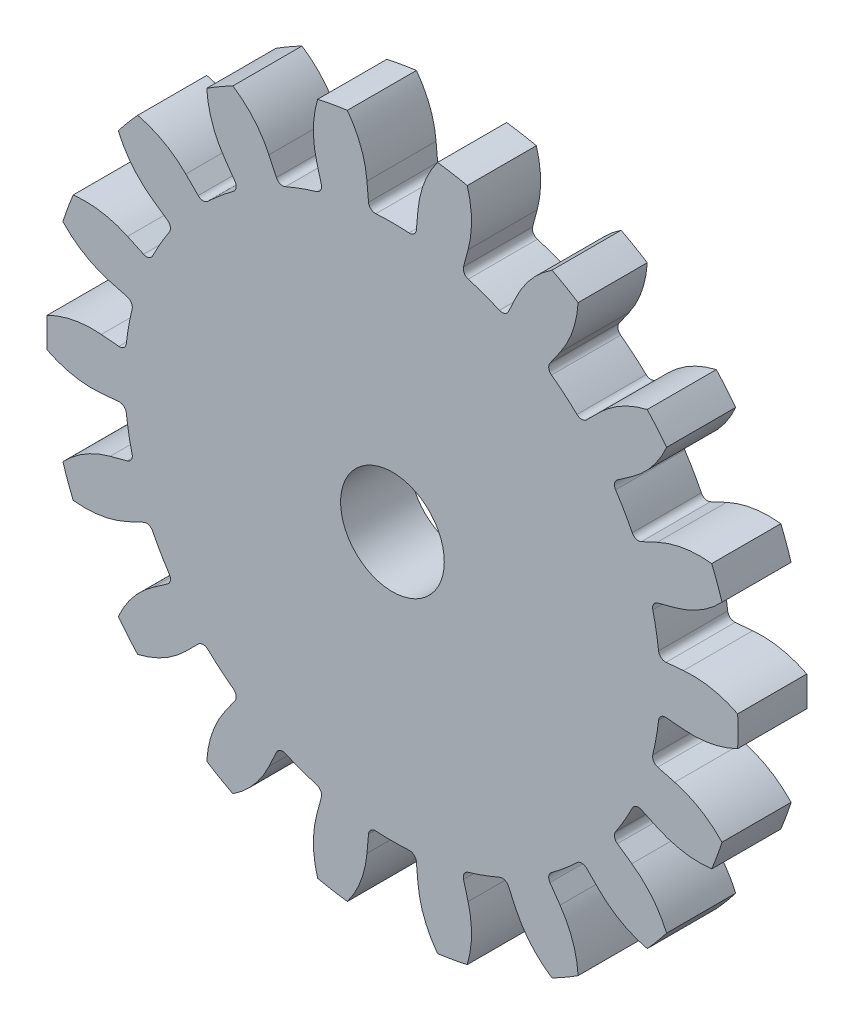
from build123d import *

# Parameters (mm, degrees)
BOSS_EXTRUDE1_DEPTH      = 10
FILLET1_R                = 1
CIRPATTERN1_COUNT        = 18
FILLET1_OF_CIRPATTERN1_R = 1
SKETCH2_R                = 7.5
CUT_EXTRUDE1_DEPTH       = 72.115450381


with BuildPart() as part:
    # Sketch1 → Boss-Extrude1 (new body)
    with BuildSketch(Plane.XY):
        with BuildLine():
            Line((42.124092809, 3.685380582), (38.602544551, 3.377285031))
            ThreePointArc((38.602544551, 3.377285031), (38.418488378, 5.057889949), (38.161300429, 6.728866885))
            Line((38.161300429, 6.728866885), (0, 0))
            Line((0, 0), (38.161300429, -6.728866885))
            ThreePointArc((38.161300429, -6.728866885), (38.418488378, -5.057889949), (38.602544551, -3.377285031))
            Line((38.602544551, -3.377285031), (42.124092809, -3.685380582))
            ThreePointArc((42.124092809, -3.685380582), (46.143152518, -3.4790331), (49.952411079, -2.180969368))
            ThreePointArc((49.952411079, -2.180969368), (50, 0), (49.952411079, 2.180969368))
            ThreePointArc((49.952411079, 2.180969368), (46.143152518, 3.4790331), (42.124092809, 3.685380582))
        make_face()
    boss_extrude1 = extrude(amount=BOSS_EXTRUDE1_DEPTH)

    # Fillet1
    fillet1_edges = [part.edges().sort_by_distance(p)[0] for p in [
        (38.602544551, 3.377285031, 5),
        (38.602544551, -3.377285031, 5),
    ]]
    fillet(fillet1_edges, radius=FILLET1_R)

    # CirPattern1: Boss-Extrude1 ×18 about axis
    cirpattern1_axis = Axis((0, 0, 0), (0, 0, 1))
    for i in range(1, CIRPATTERN1_COUNT):
        add(boss_extrude1.rotate(cirpattern1_axis, i * 360 / CIRPATTERN1_COUNT))

    # Fillet1 of CirPattern1
    fillet1_of_cirpattern1_edges = [part.edges().sort_by_distance(p)[0] for p in [
        (35.119426748, 16.376457642, 5),
        (37.429625769, 10.029237998, 5),
        (27.400387771, 27.400387771, 5),
        (31.742141716, 22.226086909, 5),
        (16.376457642, 35.119426748, 5),
        (22.226086909, 31.742141716, 5),
        (3.377285031, 38.602544551, 5),
        (10.029237998, 37.429625769, 5),
        (-10.029237998, 37.429625769, 5),
        (-3.377285031, 38.602544551, 5),
        (-22.226086909, 31.742141716, 5),
        (-16.376457642, 35.119426748, 5),
        (-31.742141716, 22.226086909, 5),
        (-27.400387771, 27.400387771, 5),
        (-37.429625769, 10.029237998, 5),
        (-35.119426748, 16.376457642, 5),
        (-38.602544551, -3.377285031, 5),
        (-38.602544551, 3.377285031, 5),
        (-35.119426748, -16.376457642, 5),
        (-37.429625769, -10.029237998, 5),
        (-27.400387771, -27.400387771, 5),
        (-31.742141716, -22.226086909, 5),
        (-16.376457642, -35.119426748, 5),
        (-22.226086909, -31.742141716, 5),
        (-3.377285031, -38.602544551, 5),
        (-10.029237998, -37.429625769, 5),
        (10.029237998, -37.429625769, 5),
        (3.377285031, -38.602544551, 5),
        (22.226086909, -31.742141716, 5),
        (16.376457642, -35.119426748, 5),
        (31.742141716, -22.226086909, 5),
        (27.400387771, -27.400387771, 5),
        (37.429625769, -10.029237998, 5),
        (35.119426748, -16.376457642, 5),
    ]]
    fillet(fillet1_of_cirpattern1_edges, radius=FILLET1_OF_CIRPATTERN1_R)

    # Sketch2 → Cut-Extrude1 (cut, through all)
    with BuildSketch(Plane.XY.offset(10)):
        Circle(SKETCH2_R)
    extrude(amount=-CUT_EXTRUDE1_DEPTH, mode=Mode.SUBTRACT)


solid = part.part
